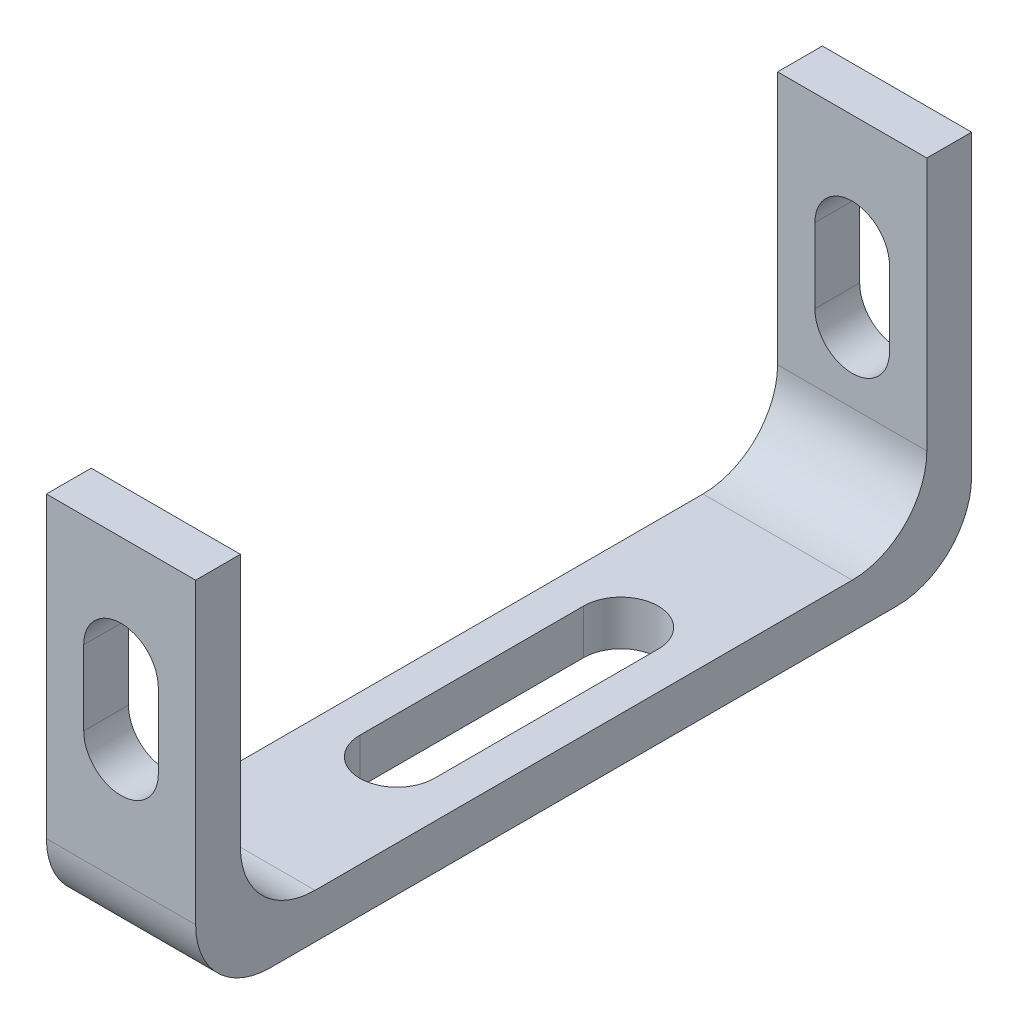
from build123d import *

# Parameters (mm, degrees)
EXTRUDE_1_DEPTH     = 10
FILLET_1_R          = 5
CUT_EXTRUDE_1_DEPTH = 58.341084747
CUT_EXTRUDE_2_DEPTH = 59.557663888


with BuildPart() as part:
    # 草图1 → 凸台-拉伸1 (new body)
    with BuildSketch(Plane(origin=(0, 0, 0), x_dir=(0, 0, -1), z_dir=(1, 0, 0))):
        Polygon((0, 0), (52, 0), (52, 25), (49, 25), (49, 3), (3, 3), (3, 25), (0, 25), align=None)
    extrude(amount=EXTRUDE_1_DEPTH)

    # 圆角1
    fillet_1_edges = [part.edges().sort_by_distance(p)[0] for p in [
        (5, 3, -3),
        (5, 3, -49),
        (5, 0, -52),
        (5, 0, 0),
    ]]
    fillet(fillet_1_edges, radius=FILLET_1_R)

    # 草图2 → 切除-拉伸1 (cut, through all)
    with BuildSketch(Plane(origin=(0, 3, 0), x_dir=(1, 0, 0), z_dir=(0, 1, 0))):
        with BuildLine():
            Line((7.5, 33.5), (7.5, 18.5))
            ThreePointArc((7.5, 18.5), (5, 16), (2.5, 18.5))
            Line((2.5, 18.5), (2.5, 33.5))
            ThreePointArc((2.5, 33.5), (5, 36), (7.5, 33.5))
        make_face()
    extrude(amount=-CUT_EXTRUDE_1_DEPTH, mode=Mode.SUBTRACT)

    # 草图3 → 切除-拉伸2 (cut, through all)
    with BuildSketch(Plane.XY):
        with BuildLine():
            Line((7.5, 17.5), (7.5, 12.5))
            ThreePointArc((7.5, 12.5), (5, 10), (2.5, 12.5))
            Line((2.5, 12.5), (2.5, 17.5))
            ThreePointArc((2.5, 17.5), (5, 20), (7.5, 17.5))
        make_face()
    extrude(amount=-CUT_EXTRUDE_2_DEPTH, mode=Mode.SUBTRACT)


solid = part.part
